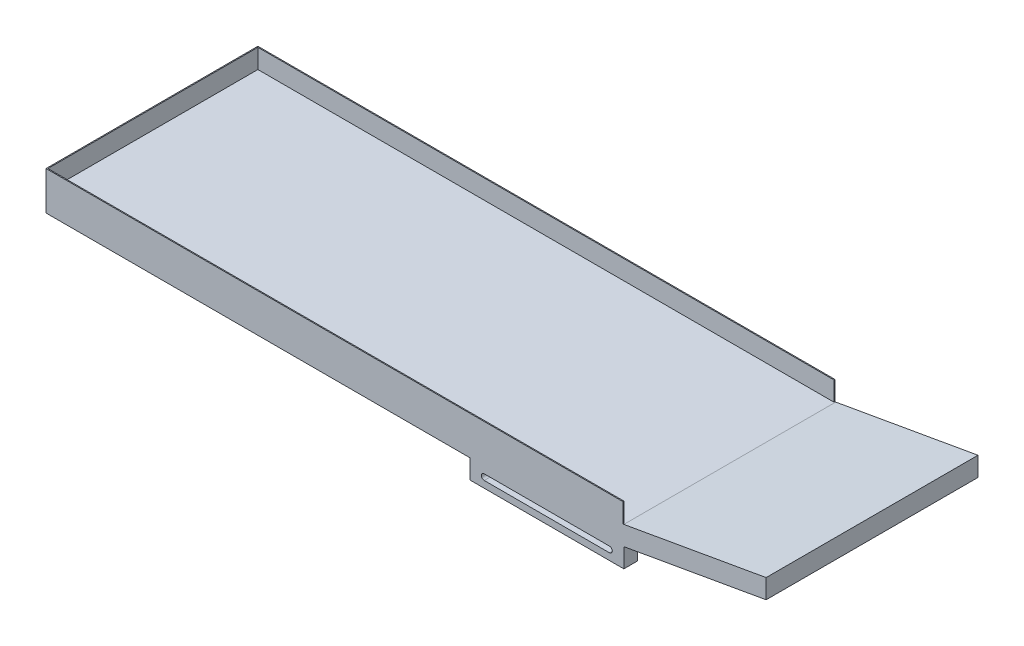
from build123d import *

# Parameters (mm, degrees)
DODANIE_WYCI_GNI_CIE1_DEPTH = 220
DODANIE_WYCI_GNI_CIE2_DEPTH = 20
SZKIC3_W                    = 160
SZKIC3_H                    = 14
DODANIE_WYCI_GNI_CIE3_DEPTH = 20
WYTNIJ_WYCI_GNI_CIE1_DEPTH  = 781.773516846


with BuildPart() as part:
    # Szkic1 → Dodanie-wyciągnięcie1 (new body)
    with BuildSketch(Plane.XY):
        Polygon((600, 0), (747.721162952, 26.04722665), (747.721162952, 46.04722665), (600, 20), (0, 20), (0, 0), align=None)
    extrude(amount=DODANIE_WYCI_GNI_CIE1_DEPTH)

    # Szkic2 → Dodanie-wyciągnięcie2 (add)
    with BuildSketch(Plane(origin=(0, 20, 0), x_dir=(1, 0, 0), z_dir=(0, 1, 0))):
        Polygon((1, -1), (599, -1), (599, 0), (0, 0), (0, -220), (599, -220), (599, -219), (1, -219), align=None)
    extrude(amount=DODANIE_WYCI_GNI_CIE2_DEPTH)

    # Szkic3 → Dodanie-wyciągnięcie3 (add)
    with BuildSketch(Plane.XZ):
        with Locations((520, 213)):
            Rectangle(SZKIC3_W, SZKIC3_H)
        with Locations((520, 7)):
            Rectangle(SZKIC3_W, SZKIC3_H)
    extrude(amount=DODANIE_WYCI_GNI_CIE3_DEPTH)

    # Szkic4 → Wytnij-wyciągnięcie1 (cut, through all)
    with BuildSketch(Plane.XY.offset(220)):
        with BuildLine():
            Line((585, -13), (455, -13))
            ThreePointArc((455, -13), (452, -10), (455, -7))
            Line((455, -7), (585, -7))
            ThreePointArc((585, -7), (588, -10), (585, -13))
        make_face()
    extrude(amount=-WYTNIJ_WYCI_GNI_CIE1_DEPTH, mode=Mode.SUBTRACT)


solid = part.part
